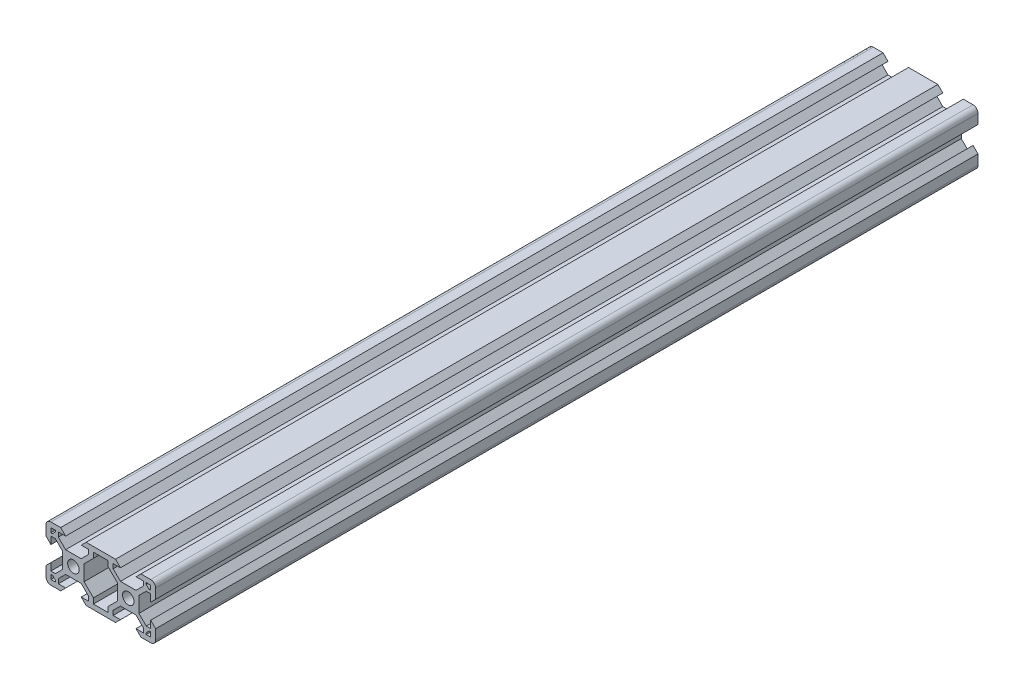
from build123d import *

# Parameters (mm, degrees)
ESQUISSE1_R        = 2.1
BOSS_EXTRU_1_DEPTH = 150


with BuildPart() as part:
    # Esquisse1 → Boss.-Extru.1 (new, symmetric)
    with BuildSketch(Plane.XY):
        with BuildLine():
            Line((-10, 3.900660172), (-12.84, 3.900660172))
            Line((-12.84, 3.900660172), (-15.499339828, 6.56))
            Line((-15.499339828, 6.56), (-15.499339828, 8.2))
            Line((-15.499339828, 8.2), (-12.84, 8.2))
            Line((-12.84, 8.2), (-14.64, 10))
            Line((-14.64, 10), (-18.2, 10))
            ThreePointArc((-18.2, 10), (-19.472792206, 9.472792206), (-20, 8.2))
            Line((-20, 8.2), (-20, 4.64))
            Line((-20, 4.64), (-18.2, 2.84))
            Line((-18.2, 2.84), (-18.2, 5.499339828))
            Line((-18.2, 5.499339828), (-16.56, 5.499339828))
            Line((-16.56, 5.499339828), (-13.900660172, 2.84))
            Line((-13.900660172, 2.84), (-13.900660172, 0))
            Line((-13.900660172, 0), (-13.900660172, -2.84))
            Line((-13.900660172, -2.84), (-16.56, -5.499339828))
            Line((-16.56, -5.499339828), (-18.2, -5.499339828))
            Line((-18.2, -5.499339828), (-18.2, -2.84))
            Line((-18.2, -2.84), (-20, -4.64))
            Line((-20, -4.64), (-20, -8.2))
            ThreePointArc((-20, -8.2), (-19.472792206, -9.472792206), (-18.2, -10))
            Line((-18.2, -10), (-14.64, -10))
            Line((-14.64, -10), (-12.84, -8.2))
            Line((-12.84, -8.2), (-15.499339828, -8.2))
            Line((-15.499339828, -8.2), (-15.499339828, -6.56))
            Line((-15.499339828, -6.56), (-12.84, -3.900660172))
            Line((-12.84, -3.900660172), (-10, -3.900660172))
            Line((-10, -3.900660172), (-7.16, -3.900660172))
            Line((-7.16, -3.900660172), (-4.500660172, -6.56))
            Line((-4.500660172, -6.56), (-4.500660172, -8.2))
            Line((-4.500660172, -8.2), (-7.16, -8.2))
            Line((-7.16, -8.2), (-5.36, -10))
            Line((-5.36, -10), (5.36, -10))
            Line((5.36, -10), (7.16, -8.2))
            Line((7.16, -8.2), (4.500660172, -8.2))
            Line((4.500660172, -8.2), (4.500660172, -6.56))
            Line((4.500660172, -6.56), (7.16, -3.900660172))
            Line((7.16, -3.900660172), (10, -3.900660172))
            Line((10, -3.900660172), (12.84, -3.900660172))
            Line((12.84, -3.900660172), (15.499339828, -6.56))
            Line((15.499339828, -6.56), (15.499339828, -8.2))
            Line((15.499339828, -8.2), (12.84, -8.2))
            Line((12.84, -8.2), (14.64, -10))
            Line((14.64, -10), (18.2, -10))
            ThreePointArc((18.2, -10), (19.472792206, -9.472792206), (20, -8.2))
            Line((20, -8.2), (20, -4.64))
            Line((20, -4.64), (18.2, -2.84))
            Line((18.2, -2.84), (18.2, -5.499339828))
            Line((18.2, -5.499339828), (16.56, -5.499339828))
            Line((16.56, -5.499339828), (13.900660172, -2.84))
            Line((13.900660172, -2.84), (13.900660172, 0))
            Line((13.900660172, 0), (13.900660172, 2.84))
            Line((13.900660172, 2.84), (16.56, 5.499339828))
            Line((16.56, 5.499339828), (18.2, 5.499339828))
            Line((18.2, 5.499339828), (18.2, 2.84))
            Line((18.2, 2.84), (20, 4.64))
            Line((20, 4.64), (20, 8.2))
            ThreePointArc((20, 8.2), (19.472792206, 9.472792206), (18.2, 10))
            Line((18.2, 10), (14.64, 10))
            Line((14.64, 10), (12.84, 8.2))
            Line((12.84, 8.2), (15.499339828, 8.2))
            Line((15.499339828, 8.2), (15.499339828, 6.56))
            Line((15.499339828, 6.56), (12.84, 3.900660172))
            Line((12.84, 3.900660172), (10, 3.900660172))
            Line((10, 3.900660172), (7.16, 3.900660172))
            Line((7.16, 3.900660172), (4.500660172, 6.56))
            Line((4.500660172, 6.56), (4.500660172, 8.2))
            Line((4.500660172, 8.2), (7.16, 8.2))
            Line((7.16, 8.2), (5.36, 10))
            Line((5.36, 10), (-5.36, 10))
            Line((-5.36, 10), (-7.16, 8.2))
            Line((-7.16, 8.2), (-4.500660172, 8.2))
            Line((-4.500660172, 8.2), (-4.500660172, 6.56))
            Line((-4.500660172, 6.56), (-7.16, 3.900660172))
            Line((-7.16, 3.900660172), (-10, 3.900660172))
        make_face()
        with Locations((-10, 0)):
            Circle(ESQUISSE1_R, mode=Mode.SUBTRACT)
        with Locations(Location((10, 0, 0), (0, 0, 180))):
            Circle(ESQUISSE1_R, mode=Mode.SUBTRACT)
        Polygon((-2.7, 8.2), (-2.7, 6.239339828), (-6.099339828, 2.84), (-6.099339828, -2.84), (-2.7, -6.239339828), (-2.7, -8.2), (2.7, -8.2), (2.7, -6.239339828), (6.099339828, -2.84), (6.099339828, 2.84), (2.7, 6.239339828), (2.7, 8.2), align=None, mode=Mode.SUBTRACT)
        Polygon((-18.2, 8.2), (-18.2, 6.569339828), (-17.63, 6.569339828), (-16.569339828, 7.63), (-16.569339828, 8.2), align=None, mode=Mode.SUBTRACT)
        Polygon((-18.2, -6.569339828), (-17.63, -6.569339828), (-16.569339828, -7.63), (-16.569339828, -8.2), (-18.2, -8.2), align=None, mode=Mode.SUBTRACT)
        Polygon((18.2, 6.569339828), (17.63, 6.569339828), (16.569339828, 7.63), (16.569339828, 8.2), (18.2, 8.2), align=None, mode=Mode.SUBTRACT)
        Polygon((18.2, -6.569339828), (17.63, -6.569339828), (16.569339828, -7.63), (16.569339828, -8.2), (18.2, -8.2), align=None, mode=Mode.SUBTRACT)
    extrude(amount=BOSS_EXTRU_1_DEPTH, both=True)


solid = part.part
